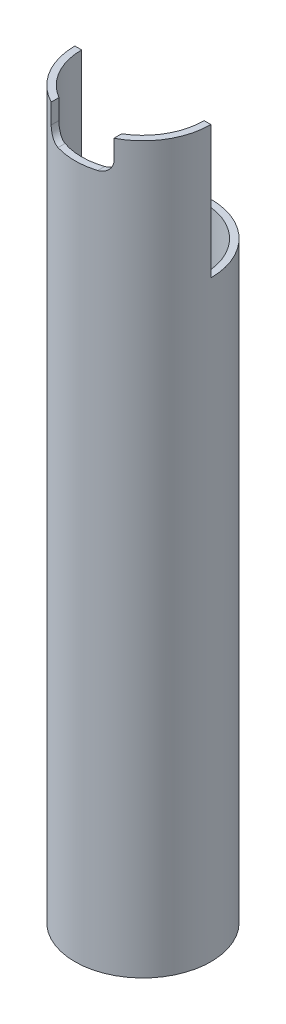
from build123d import *

# Parameters (mm, degrees)
SKETCH1_R           = 14.0975
SKETCH1_R_2         = 12.7
BOSS_EXTRUDE1_DEPTH = 152.5
SKETCH2_W           = 29.43875972
SKETCH2_H           = 15.555523124
CUT_EXTRUDE1_DEPTH  = 27.5
SKETCH3_W           = 13
SKETCH3_H           = 5.253170184
CUT_EXTRUDE2_DEPTH  = 6.5
FILLET1_R           = 2.38
SKETCH4_W           = 35.595029472
SKETCH4_H           = 37.761683439
CUT_EXTRUDE3_DEPTH  = 2.25


with BuildPart() as part:
    # Sketch1 → Boss-Extrude1 (new body)
    with BuildSketch(Plane(origin=(0, 0, 0), x_dir=(1, 0, 0), z_dir=(0, 1, 0))):
        with Locations(Location((0, 0, 0), (0, 0, 270))):
            Circle(SKETCH1_R)
        with Locations(Location((0, 0, 0), (0, 0, 270))):
            Circle(SKETCH1_R_2, mode=Mode.SUBTRACT)
    extrude(amount=BOSS_EXTRUDE1_DEPTH)

    # Sketch2 → Cut-Extrude1 (cut)
    with BuildSketch(Plane(origin=(0, 152.5, 0), x_dir=(1, 0, 0), z_dir=(0, 1, 0))):
        with Locations((0.62187986, 7.777761562)):
            Rectangle(SKETCH2_W, SKETCH2_H)
    extrude(amount=-CUT_EXTRUDE1_DEPTH, mode=Mode.SUBTRACT)

    # Sketch3 → Cut-Extrude2 (cut)
    with BuildSketch(Plane(origin=(0, 152.5, 0), x_dir=(1, 0, 0), z_dir=(0, 1, 0))):
        with Locations((0, -11.873414908)):
            Rectangle(SKETCH3_W, SKETCH3_H)
    extrude(amount=-CUT_EXTRUDE2_DEPTH, mode=Mode.SUBTRACT)

    # Fillet1
    fillet1_edges = [part.edges().sort_by_distance(p)[0] for p in [
        (6.5, 146, 11.71006097),
        (-6.5, 146, 11.71006097),
    ]]
    fillet(fillet1_edges, radius=FILLET1_R)

    # Sketch4 → Cut-Extrude3 (cut)
    with BuildSketch(Plane.XZ):
        with Locations((0.67063099, 0.361108995)):
            Rectangle(SKETCH4_W, SKETCH4_H)
    extrude(amount=-CUT_EXTRUDE3_DEPTH, mode=Mode.SUBTRACT)


solid = part.part
